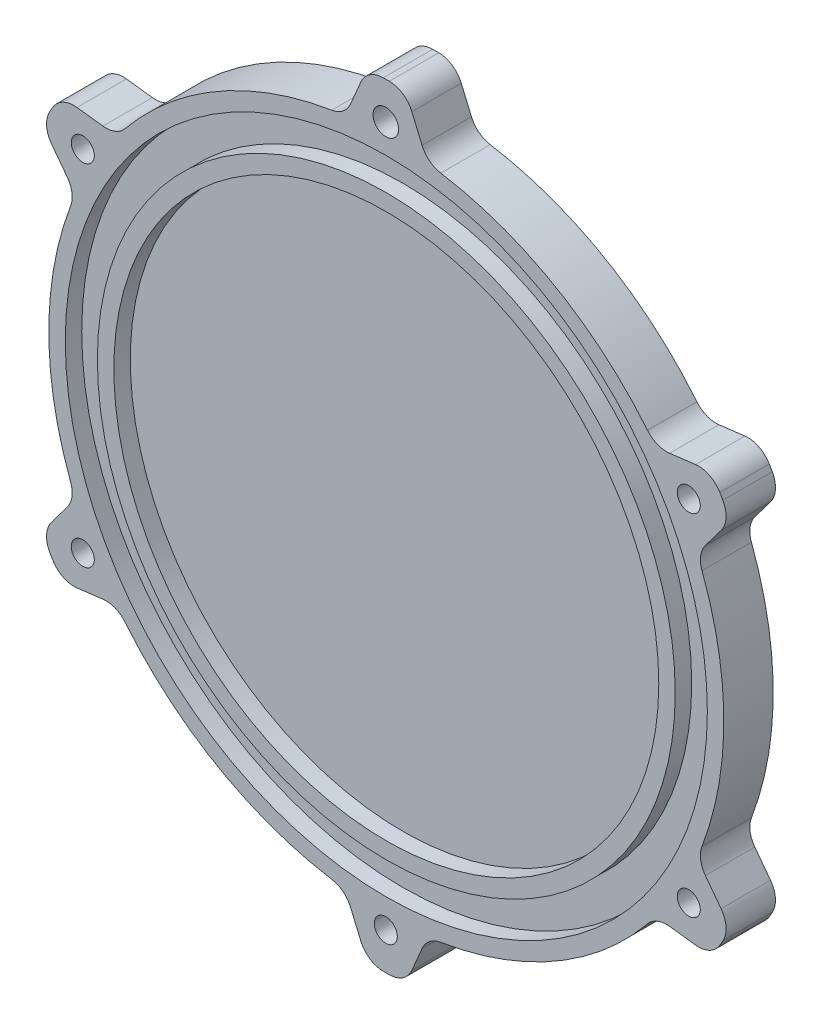
from build123d import *

# Parameters (mm, degrees)
SKETCH1_R           = 1.55
SKETCH1_R_2         = 1.4
BOSS_EXTRUDE1_DEPTH = 6
SKETCH2_R           = 39
SKETCH2_R_2         = 35.1
SKETCH2_R_3         = 33.1
CUT_EXTRUDE1_DEPTH  = 2


with BuildPart() as part:
    # Sketch1 → Boss-Extrude1 (new body)
    with BuildSketch(Plane.XY):
        with BuildLine():
            Line((-3.10553267, 45.170231176), (-4.343955751, 42.250868995))
            ThreePointArc((-4.343955751, 42.250868995), (-5.25243282, 41.063358876), (-6.621251333, 40.461821891))
            ThreePointArc((-6.621251333, 40.461821891), (-20.5, 35.507041555), (-31.730339975, 25.965082805))
            ThreePointArc((-31.730339975, 25.965082805), (-32.935695541, 25.080419692), (-34.418348006, 24.887410531))
            Line((-34.418348006, 24.887410531), (-37.565801358, 25.274585773))
            ThreePointArc((-37.565801358, 25.274585773), (-39.259871006, 24.987189905), (-40.518355186, 23.817281394))
            ThreePointArc((-40.518355186, 23.817281394), (-40.703193978, 23.5), (-40.88554833, 23.181284214))
            ThreePointArc((-40.88554833, 23.181284214), (-41.26947673, 21.506450688), (-40.671334028, 19.895645403))
            Line((-40.671334028, 19.895645403), (-38.762303757, 17.363458464))
            ThreePointArc((-38.762303757, 17.363458464), (-38.188128361, 15.982939184), (-38.351591308, 14.496739086))
            ThreePointArc((-38.351591308, 14.496739086), (-41, 0), (-38.351591308, -14.496739086))
            ThreePointArc((-38.351591308, -14.496739086), (-38.188128361, -15.982939184), (-38.762303757, -17.363458464))
            Line((-38.762303757, -17.363458464), (-40.671334028, -19.895645403))
            ThreePointArc((-40.671334028, -19.895645403), (-41.26947673, -21.506450688), (-40.88554833, -23.181284214))
            ThreePointArc((-40.88554833, -23.181284214), (-40.703193978, -23.5), (-40.518355186, -23.817281394))
            ThreePointArc((-40.518355186, -23.817281394), (-39.259871006, -24.987189905), (-37.565801358, -25.274585773))
            Line((-37.565801358, -25.274585773), (-34.418348006, -24.887410531))
            ThreePointArc((-34.418348006, -24.887410531), (-32.935695541, -25.080419692), (-31.730339975, -25.965082805))
            ThreePointArc((-31.730339975, -25.965082805), (-20.5, -35.507041555), (-6.621251333, -40.461821891))
            ThreePointArc((-6.621251333, -40.461821891), (-5.25243282, -41.063358876), (-4.343955751, -42.250868995))
            Line((-4.343955751, -42.250868995), (-3.10553267, -45.170231176))
            ThreePointArc((-3.10553267, -45.170231176), (-2.009605724, -46.493640593), (-0.367193143, -46.998565608))
            ThreePointArc((-0.367193143, -46.998565608), (0, -47), (0.367193143, -46.998565608))
            ThreePointArc((0.367193143, -46.998565608), (2.009605724, -46.493640593), (3.10553267, -45.170231176))
            Line((3.10553267, -45.170231176), (4.343955751, -42.250868995))
            ThreePointArc((4.343955751, -42.250868995), (5.25243282, -41.063358876), (6.621251333, -40.461821891))
            ThreePointArc((6.621251333, -40.461821891), (20.5, -35.507041555), (31.730339975, -25.965082805))
            ThreePointArc((31.730339975, -25.965082805), (32.935695541, -25.080419692), (34.418348006, -24.887410531))
            Line((34.418348006, -24.887410531), (37.565801358, -25.274585773))
            ThreePointArc((37.565801358, -25.274585773), (39.259871006, -24.987189905), (40.518355186, -23.817281394))
            ThreePointArc((40.518355186, -23.817281394), (40.703193978, -23.5), (40.88554833, -23.181284214))
            ThreePointArc((40.88554833, -23.181284214), (41.26947673, -21.506450688), (40.671334028, -19.895645403))
            Line((40.671334028, -19.895645403), (38.762303757, -17.363458464))
            ThreePointArc((38.762303757, -17.363458464), (38.188128361, -15.982939184), (38.351591308, -14.496739086))
            ThreePointArc((38.351591308, -14.496739086), (41, 0), (38.351591308, 14.496739086))
            ThreePointArc((38.351591308, 14.496739086), (38.188128361, 15.982939184), (38.762303757, 17.363458464))
            Line((38.762303757, 17.363458464), (40.671334028, 19.895645403))
            ThreePointArc((40.671334028, 19.895645403), (41.26947673, 21.506450688), (40.88554833, 23.181284214))
            ThreePointArc((40.88554833, 23.181284214), (40.703193978, 23.5), (40.518355186, 23.817281394))
            ThreePointArc((40.518355186, 23.817281394), (39.259871006, 24.987189905), (37.565801358, 25.274585773))
            Line((37.565801358, 25.274585773), (34.418348006, 24.887410531))
            ThreePointArc((34.418348006, 24.887410531), (32.935695541, 25.080419692), (31.730339975, 25.965082805))
            ThreePointArc((31.730339975, 25.965082805), (20.5, 35.507041555), (6.621251333, 40.461821891))
            ThreePointArc((6.621251333, 40.461821891), (5.25243282, 41.063358876), (4.343955751, 42.250868995))
            Line((4.343955751, 42.250868995), (3.10553267, 45.170231176))
            ThreePointArc((3.10553267, 45.170231176), (2.009605724, 46.493640593), (0.367193143, 46.998565608))
            ThreePointArc((0.367193143, 46.998565608), (0, 47), (-0.367193143, 46.998565608))
            ThreePointArc((-0.367193143, 46.998565608), (-2.009605724, 46.493640593), (-3.10553267, 45.170231176))
        make_face()
        with Locations((-0.063500562, 42.49999948)):
            Circle(SKETCH1_R, mode=Mode.SUBTRACT)
        with Locations((36.742579098, 21.24999948)):
            Circle(SKETCH1_R_2, mode=Mode.SUBTRACT)
        with Locations((36.742579098, -21.25000052)):
            Circle(SKETCH1_R_2, mode=Mode.SUBTRACT)
        with Locations((-0.063500562, -42.50000052)):
            Circle(SKETCH1_R_2, mode=Mode.SUBTRACT)
        with Locations((-36.869580223, -21.25000052)):
            Circle(SKETCH1_R_2, mode=Mode.SUBTRACT)
        with Locations((-36.869580223, 21.24999948)):
            Circle(SKETCH1_R_2, mode=Mode.SUBTRACT)
    extrude(amount=BOSS_EXTRUDE1_DEPTH)

    # Sketch2 → Cut-Extrude1 (cut)
    # profile 1 of 2: a face of its own
    with BuildSketch(Plane.XY.offset(6)):
        Circle(SKETCH2_R)
        Circle(SKETCH2_R_2, mode=Mode.SUBTRACT)
    # profile 2 of 2: a face of its own
    with BuildSketch(Plane.XY.offset(6)):
        Circle(SKETCH2_R_3)
    extrude(amount=-CUT_EXTRUDE1_DEPTH, mode=Mode.SUBTRACT)


solid = part.part
